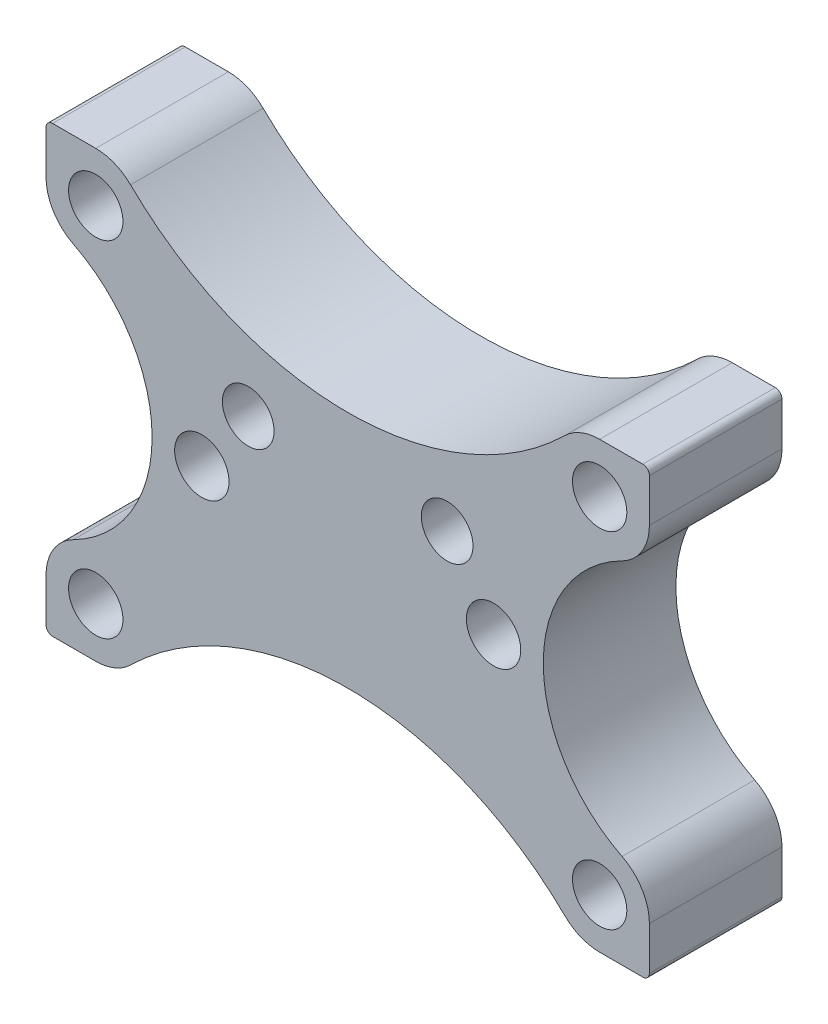
from build123d import *

# Parameters (mm, degrees)
SKETCH1_R           = 2.05
SKETCH1_R_2         = 1.95
BOSS_EXTRUDE1_DEPTH = 10
FILLET1_R           = 0.5


with BuildPart() as part:
    # Sketch1 → Boss-Extrude1 (new body)
    with BuildSketch(Plane.XY):
        with BuildLine():
            Line((-19, 16.75), (-22.75, 16.75))
            Line((-22.75, 16.75), (-22.75, 13))
            ThreePointArc((-22.75, 13), (-22.193718688, 11.034634654), (-20.689914163, 9.652360515))
            ThreePointArc((-20.689914163, 9.652360515), (-14.75, 0), (-20.689914163, -9.652360515))
            ThreePointArc((-20.689914163, -9.652360515), (-22.193718688, -11.034634654), (-22.75, -13))
            Line((-22.75, -13), (-22.75, -16.75))
            Line((-22.75, -16.75), (-19, -16.75))
            ThreePointArc((-19, -16.75), (-17.583685544, -16.472254795), (-16.377170848, -15.680161793))
            ThreePointArc((-16.377170848, -15.680161793), (0, -9), (16.377170848, -15.680161793))
            ThreePointArc((16.377170848, -15.680161793), (17.583685544, -16.472254795), (19, -16.75))
            Line((19, -16.75), (22.75, -16.75))
            Line((22.75, -16.75), (22.75, -13))
            ThreePointArc((22.75, -13), (22.193718688, -11.034634654), (20.689914163, -9.652360515))
            ThreePointArc((20.689914163, -9.652360515), (14.75, 0), (20.689914163, 9.652360515))
            ThreePointArc((20.689914163, 9.652360515), (22.193718688, 11.034634654), (22.75, 13))
            Line((22.75, 13), (22.75, 16.75))
            Line((22.75, 16.75), (19, 16.75))
            ThreePointArc((19, 16.75), (17.583685544, 16.472254795), (16.377170848, 15.680161793))
            ThreePointArc((16.377170848, 15.680161793), (0, 9), (-16.377170848, 15.680161793))
            ThreePointArc((-16.377170848, 15.680161793), (-17.583685544, 16.472254795), (-19, 16.75))
        make_face()
        with Locations((19, 13)):
            Circle(SKETCH1_R, mode=Mode.SUBTRACT)
        with Locations((-19, 13)):
            Circle(SKETCH1_R, mode=Mode.SUBTRACT)
        with Locations((-19, -13)):
            Circle(SKETCH1_R, mode=Mode.SUBTRACT)
        with Locations((19, -13)):
            Circle(SKETCH1_R, mode=Mode.SUBTRACT)
        with Locations((-11, 0)):
            Circle(SKETCH1_R, mode=Mode.SUBTRACT)
        with Locations((11, 0)):
            Circle(SKETCH1_R, mode=Mode.SUBTRACT)
        with Locations(Location((7.5, 5, 0), (0, 0, 180))):
            Circle(SKETCH1_R_2, mode=Mode.SUBTRACT)
        with Locations(Location((-7.5, 5, 0), (0, 0, 180))):
            Circle(SKETCH1_R_2, mode=Mode.SUBTRACT)
    extrude(amount=BOSS_EXTRUDE1_DEPTH)

    # Fillet1
    fillet1_edges = [part.edges().sort_by_distance(p)[0] for p in [
        (22.75, 16.75, 5),
        (22.75, -16.75, 5),
        (-22.75, -16.75, 5),
        (-22.75, 16.75, 5),
    ]]
    fillet(fillet1_edges, radius=FILLET1_R)


solid = part.part
